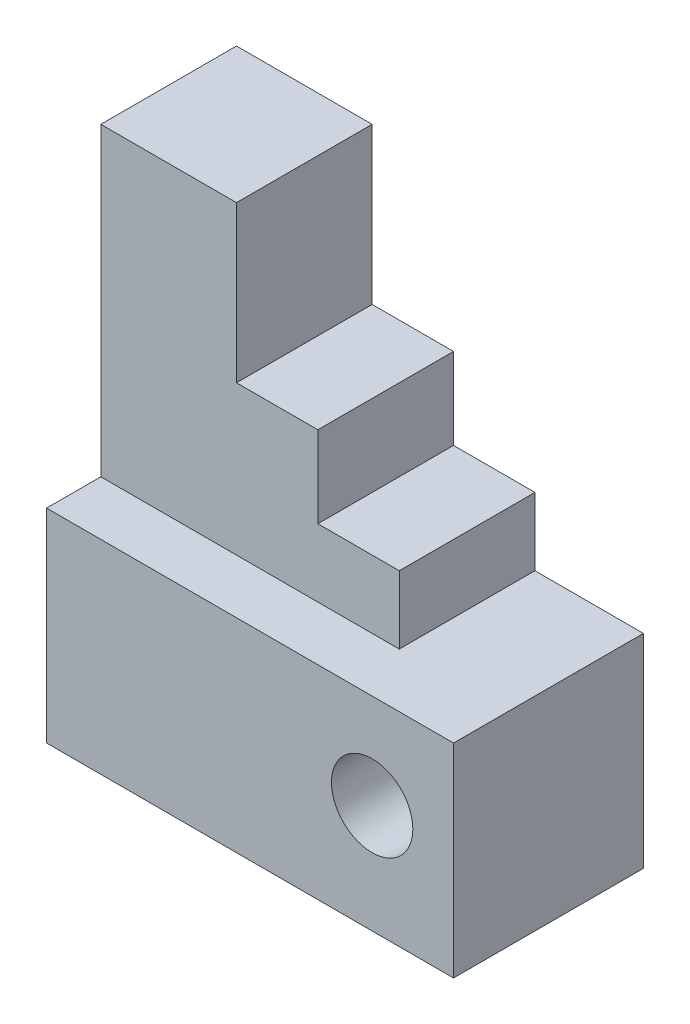
from build123d import *

# Parameters (mm, degrees)
SKETCH1_W           = 60
SKETCH1_H           = 30
SKETCH1_R           = 6
BOSS_EXTRUDE5_DEPTH = 28
BOSS_EXTRUDE6_DEPTH = 20


with BuildPart() as part:
    # Sketch1 → Boss-Extrude5 (new body)
    with BuildSketch(Plane.XY):
        with Locations((30, 15)):
            Rectangle(SKETCH1_W, SKETCH1_H)
        with Locations((48, 16)):
            Circle(SKETCH1_R, mode=Mode.SUBTRACT)
    extrude(amount=BOSS_EXTRUDE5_DEPTH)

    # Sketch7 → Boss-Extrude6 (add)
    with BuildSketch(Plane.XY):
        Polygon((44, 30), (0, 30), (0, 75), (20, 75), (20, 52), (32, 52), (32, 40), (44, 40), align=None)
    extrude(amount=BOSS_EXTRUDE6_DEPTH)


solid = part.part
